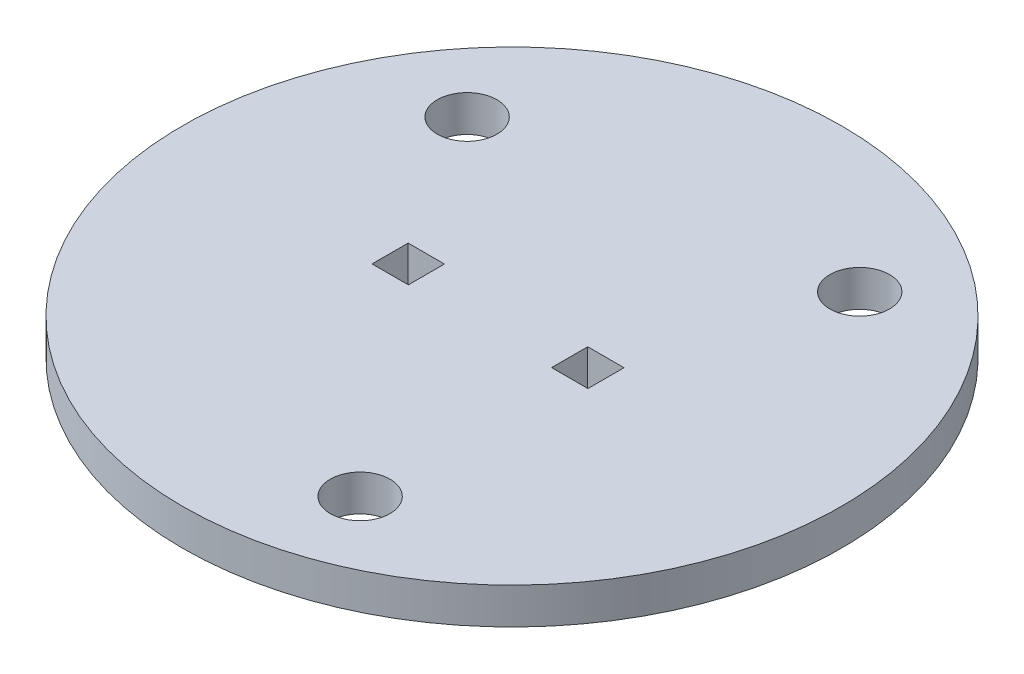
from build123d import *

# Parameters (mm, degrees)
SKETCH1_W           = 101.6
SKETCH1_H           = 101.6
BOSS_EXTRUDE1_DEPTH = 4.826
SKETCH2_OUTSIDE_W   = 132.354
SKETCH2_OUTSIDE_H   = 132.354
SKETCH2_OUTSIDE_R   = 43.815
CUT_EXTRUDE1_DEPTH  = 144.765121904
SKETCH4_R           = 3.96875
CUT_EXTRUDE3_DEPTH  = 134.892818052
SKETCH5_W           = 4.826
SKETCH5_H           = 4.800000052
CUT_EXTRUDE4_DEPTH  = 134.892818052


with BuildPart() as part:
    # Sketch1 → Boss-Extrude1 (new body)
    with BuildSketch(Plane(origin=(0, 0, 0), x_dir=(1, 0, 0), z_dir=(0, 1, 0))):
        with Locations((50.8, 50.8)):
            Rectangle(SKETCH1_W, SKETCH1_H)
    extrude(amount=BOSS_EXTRUDE1_DEPTH)

    # Sketch2 outside → Cut-Extrude1 (cut, through all)
    with BuildSketch(Plane(origin=(0, 4.826, 0), x_dir=(1, 0, 0), z_dir=(0, 1, 0))):
        with Locations((50.8, 50.8)):
            Rectangle(SKETCH2_OUTSIDE_W, SKETCH2_OUTSIDE_H)
        with Locations(Location((50.8, 50.8, 0), (0, 0, 270))):
            Circle(SKETCH2_OUTSIDE_R, mode=Mode.SUBTRACT)
    extrude(amount=-CUT_EXTRUDE1_DEPTH, mode=Mode.SUBTRACT)

    # Sketch4 → Cut-Extrude3 (cut, through all)
    with BuildSketch(Plane(origin=(0, 4.826, 0), x_dir=(1, 0, 0), z_dir=(0, 1, 0))):
        with Locations(Location((61.468, 19.939, 0), (0, 0, 270))):
            Circle(SKETCH4_R)
        with Locations(Location((71.12, 76.708, 0), (0, 0, 270))):
            Circle(SKETCH4_R)
        with Locations(Location((24.892, 70.739, 0), (0, 0, 270))):
            Circle(SKETCH4_R)
    extrude(amount=-CUT_EXTRUDE3_DEPTH, mode=Mode.SUBTRACT)

    # Sketch5 → Cut-Extrude4 (cut, through all)
    with BuildSketch(Plane(origin=(0, 4.826, 0), x_dir=(1, 0, 0), z_dir=(0, 1, 0))):
        with Locations((37.906649764, 49.898670107)):
            Rectangle(SKETCH5_W, SKETCH5_H)
        with Locations((61.782649764, 49.898670107)):
            Rectangle(SKETCH5_W, SKETCH5_H)
    extrude(amount=-CUT_EXTRUDE4_DEPTH, mode=Mode.SUBTRACT)


solid = part.part
